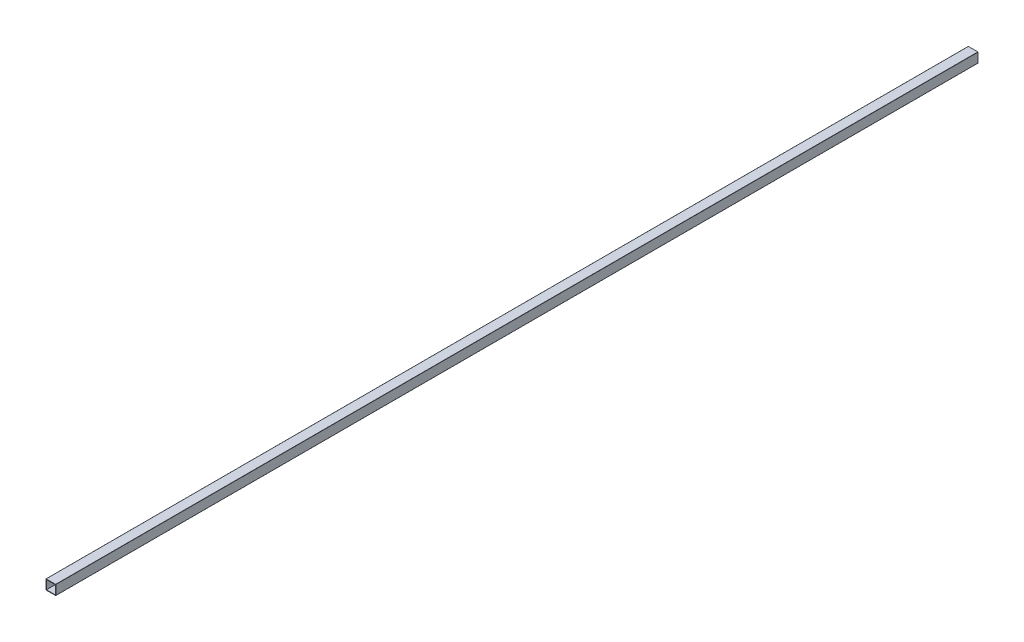
from build123d import *

# Parameters (mm, degrees)
CROQUIS1_W              = 57.42
CROQUIS1_H              = 57.42
SALIENTE_EXTRUIR1_DEPTH = 6000


with BuildPart() as part:
    # Croquis1 → Saliente-Extruir1 (new body)
    with BuildSketch(Plane.XY):
        with BuildLine():
            Line((-30.75, -31.75), (30.75, -31.75))
            ThreePointArc((30.75, -31.75), (31.457106781, -31.457106781), (31.75, -30.75))
            Line((31.75, -30.75), (31.75, 30.75))
            ThreePointArc((31.75, 30.75), (31.457106781, 31.457106781), (30.75, 31.75))
            Line((30.75, 31.75), (-30.75, 31.75))
            ThreePointArc((-30.75, 31.75), (-31.457106781, 31.457106781), (-31.75, 30.75))
            Line((-31.75, 30.75), (-31.75, -30.75))
            ThreePointArc((-31.75, -30.75), (-31.457106781, -31.457106781), (-30.75, -31.75))
        make_face()
        Rectangle(CROQUIS1_W, CROQUIS1_H, mode=Mode.SUBTRACT)
    extrude(amount=SALIENTE_EXTRUIR1_DEPTH)


solid = part.part
